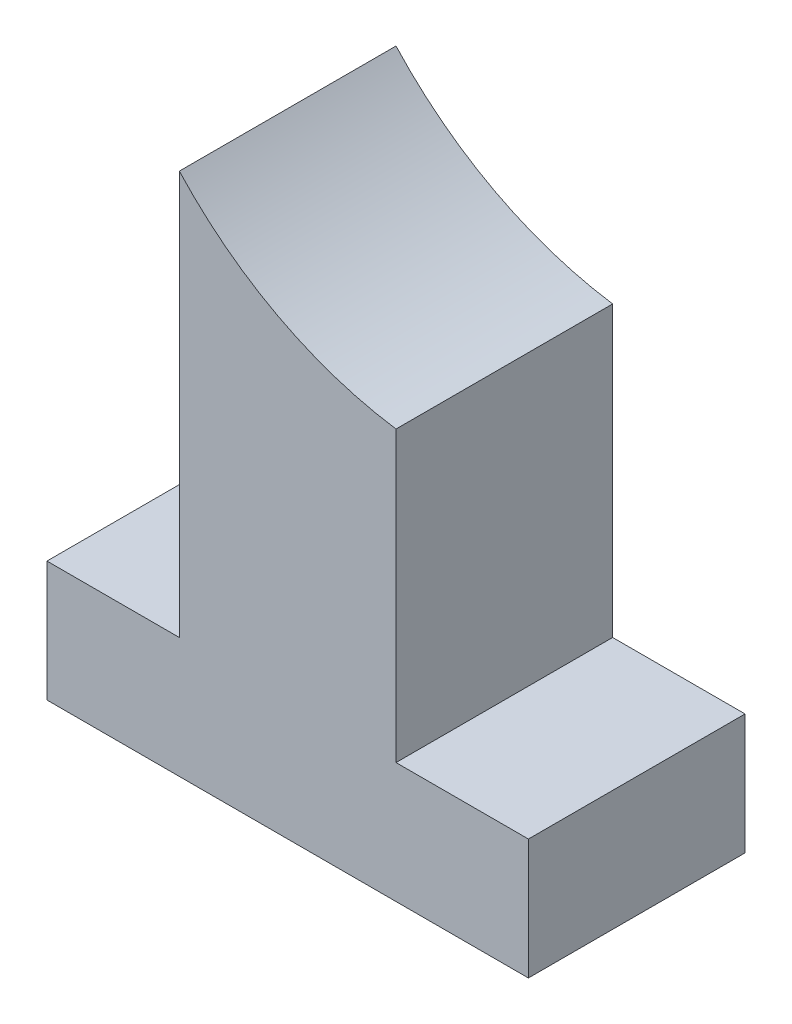
from build123d import *

# Parameters (mm, degrees)
BOSS_EXTRUDE1_DEPTH = 450


with BuildPart() as part:
    # Sketch1 → Boss-Extrude1 (new body)
    with BuildSketch(Plane.XY):
        with BuildLine():
            Line((275, 1088.944290226), (275, 250))
            Line((275, 250), (0, 250))
            Line((0, 250), (0, 0))
            Line((0, 0), (1000, 0))
            Line((1000, 0), (1000, 250))
            Line((1000, 250), (725, 250))
            Line((725, 250), (725, 850))
            ThreePointArc((725, 850), (479.466023486, 930.800832137), (275, 1088.944290226))
        make_face()
    extrude(amount=BOSS_EXTRUDE1_DEPTH)


solid = part.part
